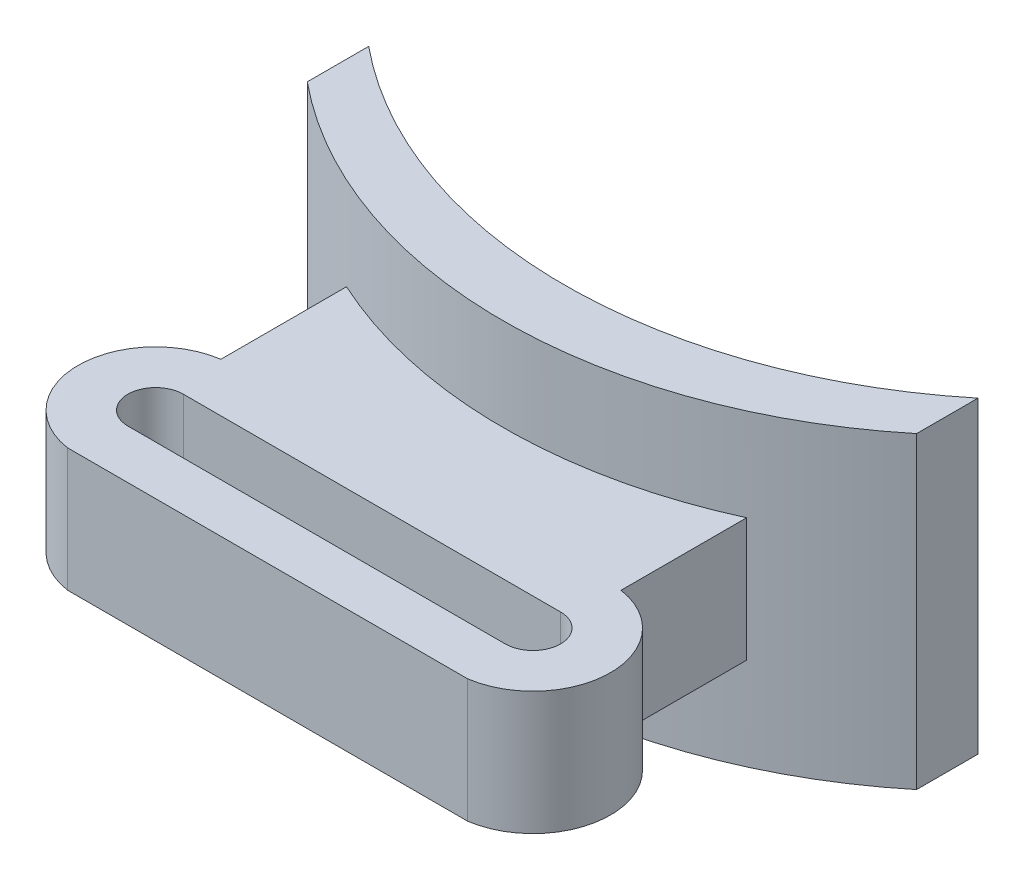
from build123d import *

# Parameters (mm, degrees)
BOSS_EXTRUDE1_DEPTH = 3.175
BOSS_EXTRUDE2_DEPTH = 1.27
CUT_EXTRUDE1_DEPTH  = 10.82505851
SCALE1_SCALE        = 2.5


with BuildPart() as part:
    # Sketch2 → Boss-Extrude1 (new, symmetric)
    with BuildSketch(Plane(origin=(0, 0, 0), x_dir=(1, 0, 0), z_dir=(0, 1, 0))):
        with BuildLine():
            Line((-6.274527226, 2.24054867), (-6.274527226, 0.976118894))
            ThreePointArc((-6.274527226, 0.976118894), (0, -1.27), (6.274527226, 0.976118894))
            Line((6.274527226, 0.976118894), (6.274527226, 2.24054867))
            ThreePointArc((6.274527226, 2.24054867), (0, 0), (-6.274527226, 2.24054867))
        make_face()
    extrude(amount=BOSS_EXTRUDE1_DEPTH, both=True)

    # Sketch3 → Boss-Extrude2 (add, symmetric)
    with BuildSketch(Plane(origin=(0, 0, 0), x_dir=(1, 0, 0), z_dir=(0, 1, 0))):
        with BuildLine():
            Line((-4.120326649, -0.370528697), (4.120326649, -0.370528697))
            Line((4.120326649, -0.370528697), (4.120326649, -2.957433704))
            ThreePointArc((4.120326649, -2.957433704), (5.482164962, -4.536659699), (4.120326649, -6.115885694))
            Line((4.120326649, -6.115885694), (-4.120326649, -6.115885694))
            ThreePointArc((-4.120326649, -6.115885694), (-5.482164962, -4.536659699), (-4.120326649, -2.957433704))
            Line((-4.120326649, -2.957433704), (-4.120326649, -0.370528697))
        make_face()
    extrude(amount=BOSS_EXTRUDE2_DEPTH, both=True)

    # Sketch4 → Cut-Extrude1 (cut, through all)
    with BuildSketch(Plane(origin=(0, 1.27, 0), x_dir=(1, 0, 0), z_dir=(0, 1, 0))):
        with BuildLine():
            Line((-3.885588375, -3.966918266), (3.885588375, -3.966918266))
            ThreePointArc((3.885588375, -3.966918266), (4.455329808, -4.536659699), (3.885588375, -5.106401132))
            Line((3.885588375, -5.106401132), (-3.885588375, -5.106401132))
            ThreePointArc((-3.885588375, -5.106401132), (-4.455329808, -4.536659699), (-3.885588375, -3.966918266))
        make_face()
    extrude(amount=-CUT_EXTRUDE1_DEPTH, mode=Mode.SUBTRACT)


with BuildPart() as part_1:
    # Scale1: scaled about (0, 0, 1.671454739)
    add(part.part.scale(SCALE1_SCALE).moved(Location((0, 0, -2.507182109))))


solid = part_1.part
